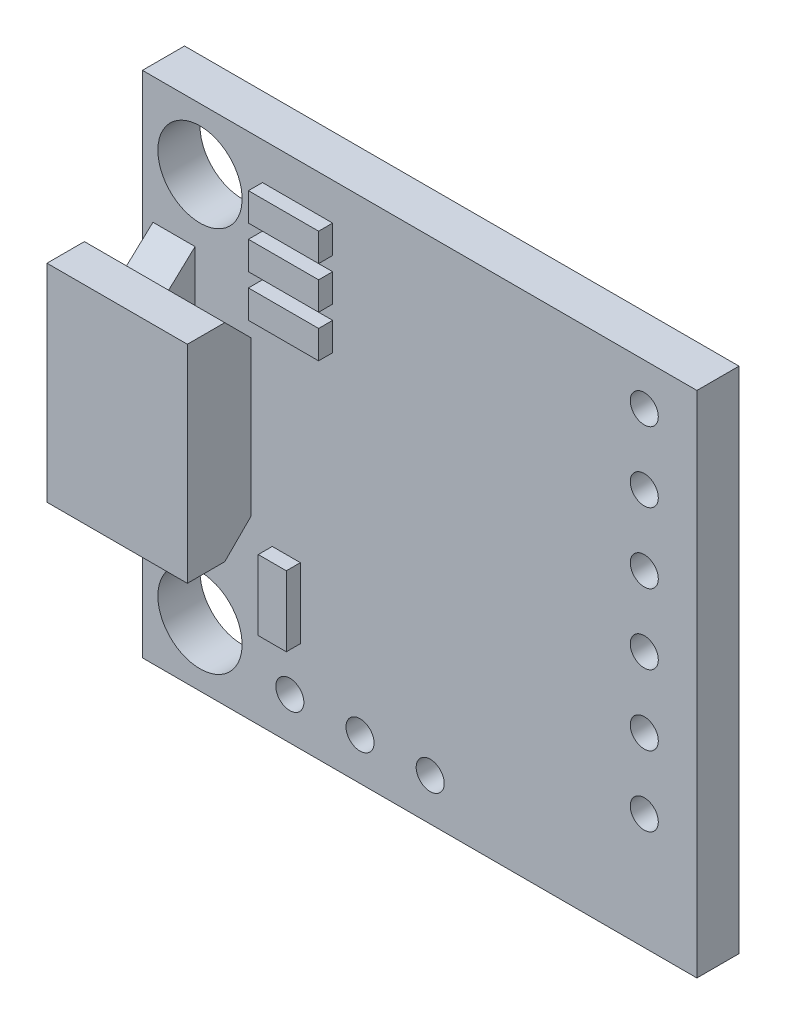
from build123d import *

# Parameters (mm, degrees)
SKETCH1_W           = 20.066
SKETCH1_H           = 18.415
SKETCH1_R           = 1.524
EXTRUDE1_DEPTH      = 1.524
EXTRUDE2_DEPTH      = 1.143
EXTRUDE2_DEPTH_BACK = 3.937
SKETCH3_R           = 0.508
EXTRUDE3_DEPTH      = 15.663683105
LPATTERN1_COUNT     = 6
LPATTERN1_PITCH     = 2.54
SKETCH4_R           = 0.508
EXTRUDE4_DEPTH      = 15.663683105
LPATTERN2_COUNT     = 3
LPATTERN2_PITCH     = 2.54
SKETCH5_W           = 2.54
SKETCH5_H           = 1.016
SKETCH5_W_2         = 1.016
SKETCH5_H_2         = 2.54
KEEPAWAY_DEPTH      = 0.508
EXTRUDE6_START      = -1.524
EXTRUDE6_DEPTH      = 1.524


with BuildPart() as part:
    # Sketch1 → Extrude1 (new body)
    with BuildSketch(Plane.XY):
        Rectangle(SKETCH1_W, SKETCH1_H)
        with Locations(Location((-7.9502, 6.985, 0), (0, 0, 180))):
            Circle(SKETCH1_R, mode=Mode.SUBTRACT)
        with Locations(Location((-7.9502, -6.985, 0), (0, 0, 180))):
            Circle(SKETCH1_R, mode=Mode.SUBTRACT)
    extrude(amount=EXTRUDE1_DEPTH)

    # Sketch2 → Extrude2 (add, two sides: drawn at the far end of the back side and taken through both)
    with BuildSketch(Plane.ZY.offset(10.033).offset(-EXTRUDE2_DEPTH_BACK)):
        Polygon((3.8354, 3.7465), (3.8354, -3.7465), (2.481413228, -3.7465), (1.524, -2.789086772), (1.524, 2.789086772), (2.481413228, 3.7465), align=None)
    extrude(amount=EXTRUDE2_DEPTH + EXTRUDE2_DEPTH_BACK)

    # Sketch3 → Extrude3 (cut, through all)
    with BuildSketch(Plane.XY.offset(1.524)):
        with Locations((8.128, 7.6835)):
            Circle(SKETCH3_R)
    extrude3 = extrude(amount=-EXTRUDE3_DEPTH, mode=Mode.SUBTRACT)

    # LPattern1: Extrude3 ×6
    with Locations(*[(0, -i * LPATTERN1_PITCH, 0) for i in range(1, LPATTERN1_COUNT)]):
        add(extrude3, mode=Mode.SUBTRACT)

    # Sketch4 → Extrude4 (cut, through all)
    with BuildSketch(Plane.XY.offset(1.524)):
        with Locations((-4.699, -7.6835)):
            Circle(SKETCH4_R)
    extrude4 = extrude(amount=-EXTRUDE4_DEPTH, mode=Mode.SUBTRACT)

    # LPattern2: Extrude4 ×3
    with Locations(*[(i * LPATTERN2_PITCH, 0, 0) for i in range(1, LPATTERN2_COUNT)]):
        add(extrude4, mode=Mode.SUBTRACT)

    # Sketch5 → KeepAway (add)
    with BuildSketch(Plane.XY.offset(1.524)):
        with Locations((-4.4196, 7.3533)):
            Rectangle(SKETCH5_W, SKETCH5_H)
        with Locations((-4.4196, 5.8293)):
            Rectangle(SKETCH5_W, SKETCH5_H)
        with Locations((-4.4196, 4.3053)):
            Rectangle(SKETCH5_W, SKETCH5_H)
        with Locations((-4.826, -4.6355)):
            Rectangle(SKETCH5_W_2, SKETCH5_H_2)
    extrude(amount=KEEPAWAY_DEPTH)

    # Sketch6 → Extrude6 (add)
    with BuildSketch(Plane.ZY.offset(11.176).offset(EXTRUDE6_START)):
        Polygon((1.524, 4.6355), (1.524, 2.789086772), (2.481413228, 3.7465), align=None)
        Polygon((1.524, -2.789086772), (1.524, -4.6355), (2.481413228, -3.7465), align=None)
    extrude(amount=-EXTRUDE6_DEPTH)


solid = part.part
